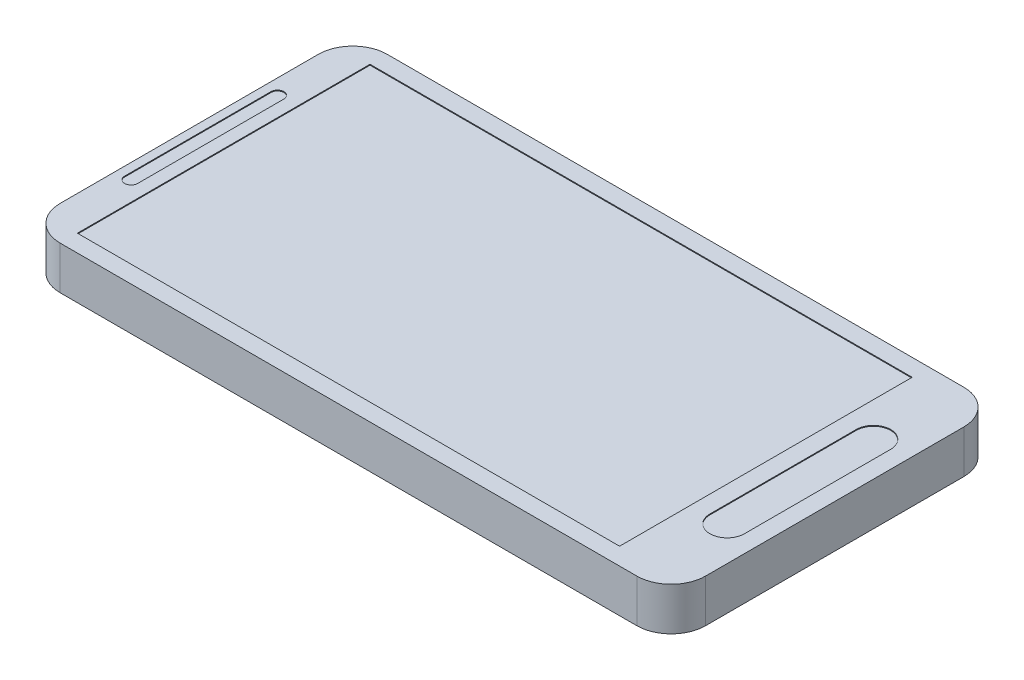
from build123d import *

# Parameters (mm, degrees)
SKETCH1_W           = 150
SKETCH1_H           = 76
BOSS_EXTRUDE1_DEPTH = 10
SKETCH2_W           = 126
SKETCH2_H           = 68
CUT_EXTRUDE1_DEPTH  = 0.2
FILLET1_R           = 8


with BuildPart() as part:
    # Sketch1 → Boss-Extrude1 (new body)
    with BuildSketch(Plane(origin=(0, 0, 0), x_dir=(1, 0, 0), z_dir=(0, 1, 0))):
        with Locations((75, 38)):
            Rectangle(SKETCH1_W, SKETCH1_H)
    extrude(amount=BOSS_EXTRUDE1_DEPTH)

    # Sketch2 → Cut-Extrude1 (cut)
    with BuildSketch(Plane(origin=(0, 10, 0), x_dir=(1, 0, 0), z_dir=(0, 1, 0))):
        with Locations((71, 38)):
            Rectangle(SKETCH2_W, SKETCH2_H)
        with BuildLine():
            Line((138, 21), (138, 55))
            ThreePointArc((138, 55), (142, 59), (146, 55))
            Line((146, 55), (146, 21))
            ThreePointArc((146, 21), (142, 17), (138, 21))
        make_face()
        with BuildLine():
            Line((5, 55), (5, 21))
            ThreePointArc((5, 21), (3.5, 19.5), (2, 21))
            Line((2, 21), (2, 55))
            ThreePointArc((2, 55), (3.5, 56.5), (5, 55))
        make_face()
    extrude(amount=-CUT_EXTRUDE1_DEPTH, mode=Mode.SUBTRACT)

    # Fillet1
    fillet1_edges = [part.edges().sort_by_distance(p)[0] for p in [
        (0, 5, -76),
        (150, 5, -76),
        (150, 5, 0),
        (0, 5, 0),
    ]]
    fillet(fillet1_edges, radius=FILLET1_R)


solid = part.part
